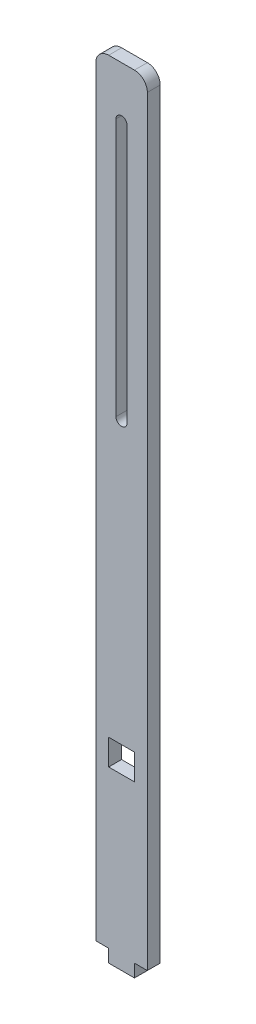
from build123d import *

# Parameters (mm, degrees)
BOSS_EXTRU_1_DEPTH      = 6.35
ESQUISSE3_W             = 12.7
ESQUISSE3_H             = 12.7
ENL_V_MAT_EXTRU_1_DEPTH = 198.361432403
ENL_V_MAT_EXTRU_2_DEPTH = 198.361432403
CONG_1_R                = 6.35


with BuildPart() as part:
    # Esquisse2 → Boss.-Extru.1 (new body)
    with BuildSketch(Plane.XY):
        Polygon((6.35, -190.5), (12.7, -190.5), (12.7, 190.5), (-12.7, 190.5), (-12.7, -190.5), (-6.35, -190.5), (-6.35, -196.85), (6.35, -196.85), align=None)
    extrude(amount=BOSS_EXTRU_1_DEPTH)

    # Esquisse3 → Enlèv. mat.-Extru.1 (cut, through all)
    with BuildSketch(Plane.XY.offset(6.35)):
        with Locations((0, -106.82478)):
            Rectangle(ESQUISSE3_W, ESQUISSE3_H)
    extrude(amount=-ENL_V_MAT_EXTRU_1_DEPTH, mode=Mode.SUBTRACT)

    # Esquisse4 → Enlèv. mat.-Extru.2 (cut, through all)
    with BuildSketch(Plane.XY.offset(6.35)):
        with BuildLine():
            Line((2.75, 165.1), (2.75, 38.1))
            ThreePointArc((2.75, 38.1), (0, 35.35), (-2.75, 38.1))
            Line((-2.75, 38.1), (-2.75, 165.1))
            ThreePointArc((-2.75, 165.1), (0, 167.85), (2.75, 165.1))
        make_face()
    extrude(amount=-ENL_V_MAT_EXTRU_2_DEPTH, mode=Mode.SUBTRACT)

    # Congé1
    cong_1_edges = [part.edges().sort_by_distance(p)[0] for p in [
        (-12.7, 190.5, 3.175),
        (12.7, 190.5, 3.175),
    ]]
    fillet(cong_1_edges, radius=CONG_1_R)


solid = part.part
